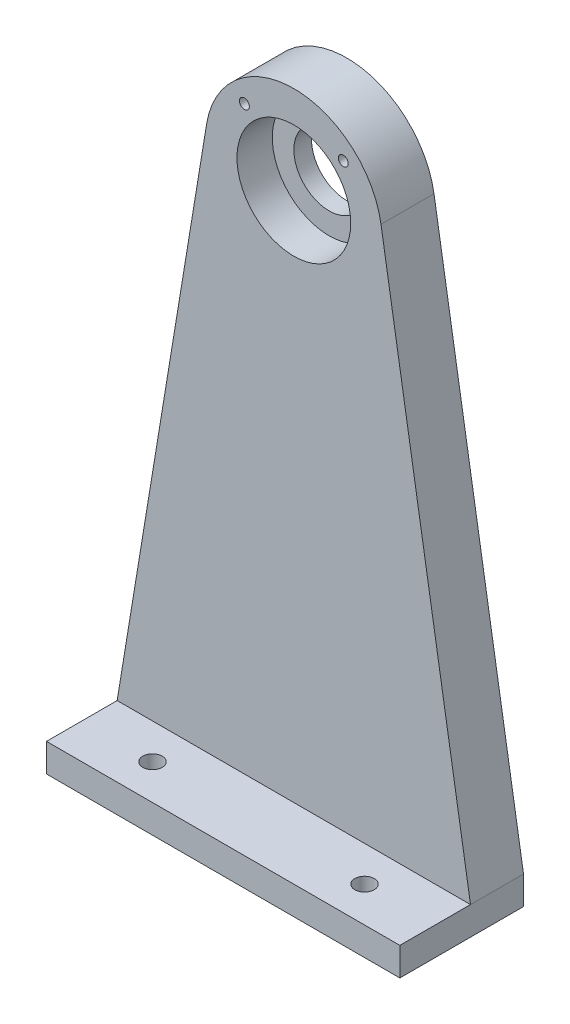
from build123d import *

# Parameters (mm, degrees)
BOSS_EXTRUDE1_DEPTH = 7.5
SKETCH7_W           = 100
SKETCH7_H           = 35
BOSS_EXTRUDE2_DEPTH = 8
SKETCH5_R           = 16.1
CUT_EXTRUDE1_DEPTH  = 10
SKETCH6_R           = 10
CUT_EXTRUDE2_DEPTH  = 20
SKETCH11_R          = 1.4
CUT_EXTRUDE3_DEPTH  = 8
SKETCH12_R          = 1.4
CUT_EXTRUDE4_DEPTH  = 8


with BuildPart() as part:
    # Sketch1 → Boss-Extrude1 (new, symmetric)
    with BuildSketch(Plane.XY):
        with BuildLine():
            Line((24.668742494, 4.056247498), (50, -150))
            Line((50, -150), (-50, -150))
            Line((-50, -150), (-24.668742494, 4.056247498))
            ThreePointArc((-24.668742494, 4.056247498), (0, 25), (24.668742494, 4.056247498))
        make_face()
    extrude(amount=BOSS_EXTRUDE1_DEPTH, both=True)

    # Sketch7 → Boss-Extrude2 (add)
    with BuildSketch(Plane.XZ.offset(150)):
        with Locations((0, 10)):
            Rectangle(SKETCH7_W, SKETCH7_H)
    extrude(amount=BOSS_EXTRUDE2_DEPTH)

    # Sketch5 → Cut-Extrude1 (cut)
    with BuildSketch(Plane.XY.offset(7.5)):
        Circle(SKETCH5_R)
    extrude(amount=-CUT_EXTRUDE1_DEPTH, mode=Mode.SUBTRACT)

    # Sketch6 → Cut-Extrude2 (cut)
    with BuildSketch(Plane.XY.offset(-2.5)):
        Circle(SKETCH6_R)
    extrude(amount=-CUT_EXTRUDE2_DEPTH, mode=Mode.SUBTRACT)

    # Sketch10 → M5 Clearance Hole1 (revolve, cut)
    with BuildSketch(Plane(origin=(-30, -150, 17.5), x_dir=(0, 0, 1), z_dir=(1, 0, 0))):
        Polygon((0, 0), (0, 11.652366702), (2.75, 10), (2.75, 0), align=None)
    m5_clearance_hole1 = revolve(axis=Axis((-30, -143.65, 17.5), (0, -1, 0)), mode=Mode.SUBTRACT)

    # Mirror1: M5 Clearance Hole1 across plane
    add(m5_clearance_hole1.mirror(Plane(origin=(0, 0, 0), x_dir=(0, 0, 1), z_dir=(1, 0, 0))), mode=Mode.SUBTRACT)

    # Sketch11 → Cut-Extrude3 (cut)
    with BuildSketch(Plane.XY.offset(7.5)):
        with Locations((14, 14.282856857)):
            Circle(SKETCH11_R)
        with Locations((-14, 14.282856857)):
            Circle(SKETCH11_R)
    extrude(amount=-CUT_EXTRUDE3_DEPTH, mode=Mode.SUBTRACT)

    # Sketch12 → Cut-Extrude4 (cut)
    with BuildSketch(Plane(origin=(0, 0, -7.5), x_dir=(-1, 0, 0), z_dir=(0, 0, -1))):
        with Locations((9, -50)):
            Circle(SKETCH12_R)
        with Locations((-9, -50)):
            Circle(SKETCH12_R)
    extrude(amount=-CUT_EXTRUDE4_DEPTH, mode=Mode.SUBTRACT)


solid = part.part
